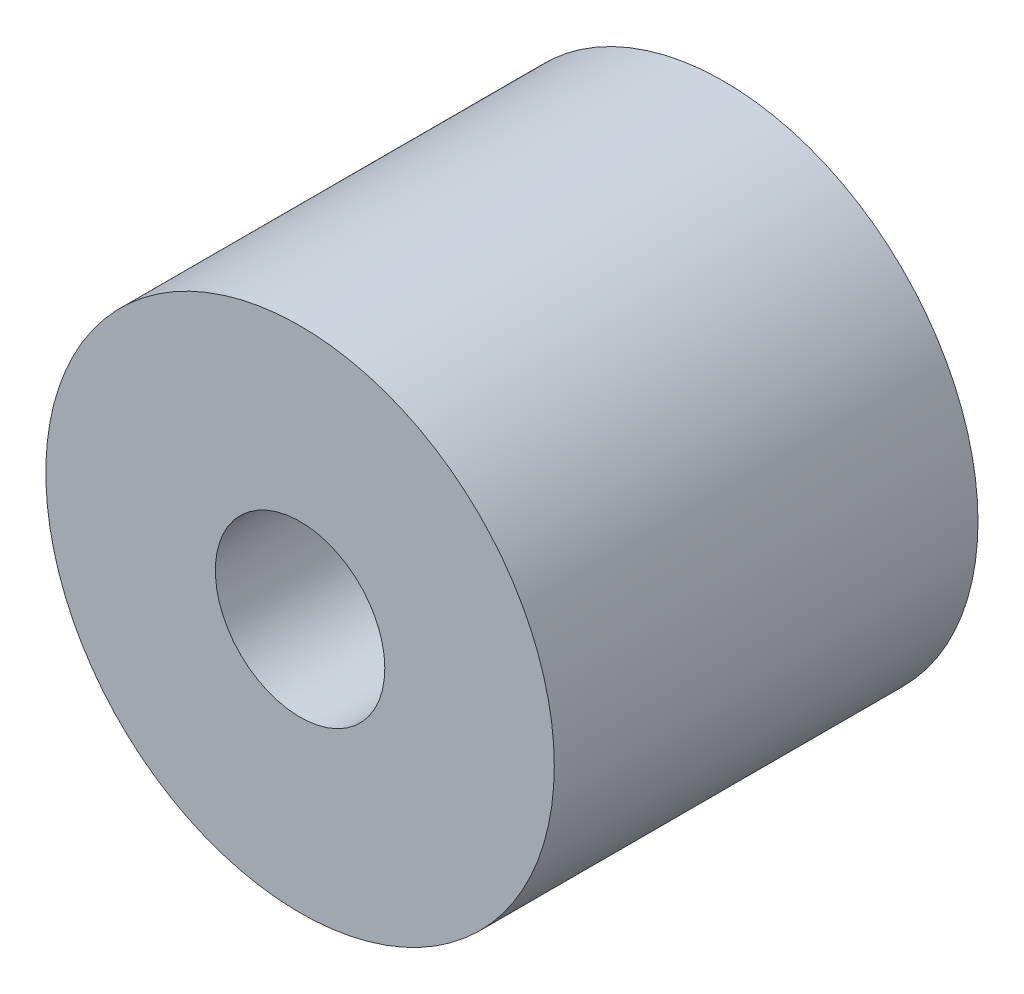
from build123d import *

# Parameters (mm, degrees)
SKETCH_1_R          = 3
EXTRUDE_1_DEPTH     = 5
SKETCH_2_R          = 1
CUT_EXTRUDE_1_DEPTH = 7.557438524


with BuildPart() as part:
    # 草图1 → 凸台-拉伸1 (new body)
    with BuildSketch(Plane.XY):
        Circle(SKETCH_1_R)
    extrude(amount=EXTRUDE_1_DEPTH)

    # 草图2 → 切除-拉伸1 (cut, through all)
    with BuildSketch(Plane.XY.offset(5)):
        Circle(SKETCH_2_R)
    extrude(amount=-CUT_EXTRUDE_1_DEPTH, mode=Mode.SUBTRACT)


solid = part.part
